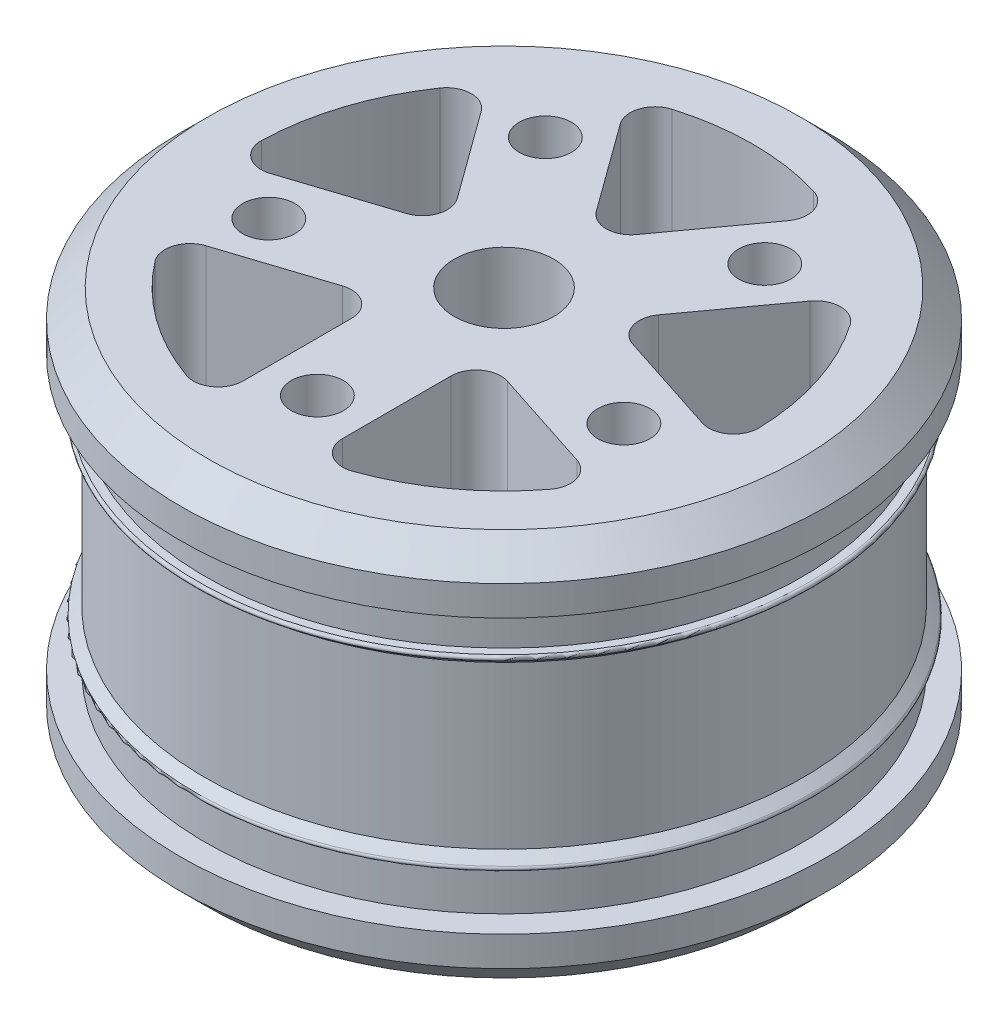
from build123d import *

# Parameters (mm, degrees)
FILLET_1_R               = 0.2
CUT_EXTRUDE_2_REACH      = 50.223
PATTERN_CIRCULAR_1_COUNT = 5
CUT_EXTRUDE_3_REACH      = 50.223
SKETCH_8_R               = 4
CUT_EXTRUDE_4_REACH      = 50.223
SKETCH_9_R               = 2.1
PATTERN_CIRCULAR_2_COUNT = 5
CHAMFER_1_SIZE           = 2.2


with BuildPart() as part:
    # 草图2 → 旋转1 (revolve)
    with BuildSketch(Plane.XY, mode=Mode.PRIVATE) as revolve_1_sk:
        Polygon((0, 15.6), (0, -15.6), (26, -15.6), (26, -11), (24, -11), (24, -7.5), (25.2, -7.5), (24, -6.5), (24, 6.5), (25.2, 7.5), (24, 7.5), (24, 11), (26, 11), (26, 15.6), align=None)
    revolve(revolve_1_sk.sketch.rotate(Axis((0, 24.034054419, 0), (0, -1, 0)), 180), axis=Axis((0, 24.034054419, 0), (0, -1, 0)))

    # 圆角1
    fillet_1_edges = [part.edges().sort_by_distance(p)[0] for p in [
        (25.2, 7.5, 0),
        (25.2, -7.5, 0),
    ]]
    fillet(fillet_1_edges, radius=FILLET_1_R)

    # 草图6 → 切除-拉伸2 (cut, up to next)
    with BuildSketch(Plane.XZ.offset(15.6), mode=Mode.PRIVATE) as cut_extrude_2_sk1:
        with BuildLine():
            Line((9.090169944, -1.25227364), (17.376032265, 1.439966228))
            ThreePointArc((17.376032265, 1.439966228), (19.190312951, 1.140661306), (19.993406948, -0.513496449))
            ThreePointArc((19.993406948, -0.513496449), (19.021130326, -6.180339887), (16.476831637, -11.336402393))
            ThreePointArc((16.476831637, -11.336402393), (14.854825412, -12.202597321), (13.211114484, -11.378332658))
            Line((13.211114484, -11.378332658), (8.090169944, -4.329957177))
            ThreePointArc((8.090169944, -4.329957177), (7.8060909, -2.536352684), (9.090169944, -1.25227364))
        make_face()
    cut_extrude_2_tool1 = extrude(cut_extrude_2_sk1.sketch, amount=-CUT_EXTRUDE_2_REACH, mode=Mode.PRIVATE) & part.part
    cut_extrude_2 = cut_extrude_2_tool1.solids().sort_by_distance((14.482969, -15.6, -4.705802))[0]
    add(cut_extrude_2, mode=Mode.SUBTRACT)

    # 阵列(圆周)1: 切除-拉伸2 ×5 about axis
    pattern_circular_1_axis = Axis((0, 0, 0), (0, 1, 0))
    for i in range(1, PATTERN_CIRCULAR_1_COUNT):
        add(cut_extrude_2.rotate(pattern_circular_1_axis, i * 360 / PATTERN_CIRCULAR_1_COUNT), mode=Mode.SUBTRACT)

    # 草图8 → 切除-拉伸3 (cut, up to next)
    with BuildSketch(Plane(origin=(0, 15.6, 0), x_dir=(1, 0, 0), z_dir=(0, 1, 0)), mode=Mode.PRIVATE) as cut_extrude_3_sk1:
        with Locations(Location((0, 0, 0), (0, 0, 180))):
            Circle(SKETCH_8_R)
    cut_extrude_3_tool1 = extrude(cut_extrude_3_sk1.sketch, amount=-CUT_EXTRUDE_3_REACH, mode=Mode.PRIVATE) & part.part
    add(cut_extrude_3_tool1.solids().sort_by_distance((0, 15.6, 0))[0], mode=Mode.SUBTRACT)

    # 草图9 → 切除-拉伸4 (cut, up to next)
    with BuildSketch(Plane(origin=(0, 15.6, 0), x_dir=(1, 0, 0), z_dir=(0, 1, 0)), mode=Mode.PRIVATE) as cut_extrude_4_sk1:
        with Locations(Location((0, -15, 0), (0, 0, 180))):
            Circle(SKETCH_9_R)
    cut_extrude_4_tool1 = extrude(cut_extrude_4_sk1.sketch, amount=-CUT_EXTRUDE_4_REACH, mode=Mode.PRIVATE) & part.part
    cut_extrude_4 = cut_extrude_4_tool1.solids().sort_by_distance((0, 15.6, 15))[0]
    add(cut_extrude_4, mode=Mode.SUBTRACT)

    # 阵列(圆周)2: 切除-拉伸4 ×5 about axis
    pattern_circular_2_axis = Axis((0, 0, 0), (0, 1, 0))
    for i in range(1, PATTERN_CIRCULAR_2_COUNT):
        add(cut_extrude_4.rotate(pattern_circular_2_axis, i * 360 / PATTERN_CIRCULAR_2_COUNT), mode=Mode.SUBTRACT)

    # 倒角1
    chamfer_1_edges = [part.edges().sort_by_distance(p)[0] for p in [
        (26, -15.6, 0),
        (26, 15.6, 0),
    ]]
    chamfer(chamfer_1_edges, length=CHAMFER_1_SIZE)


solid = part.part
